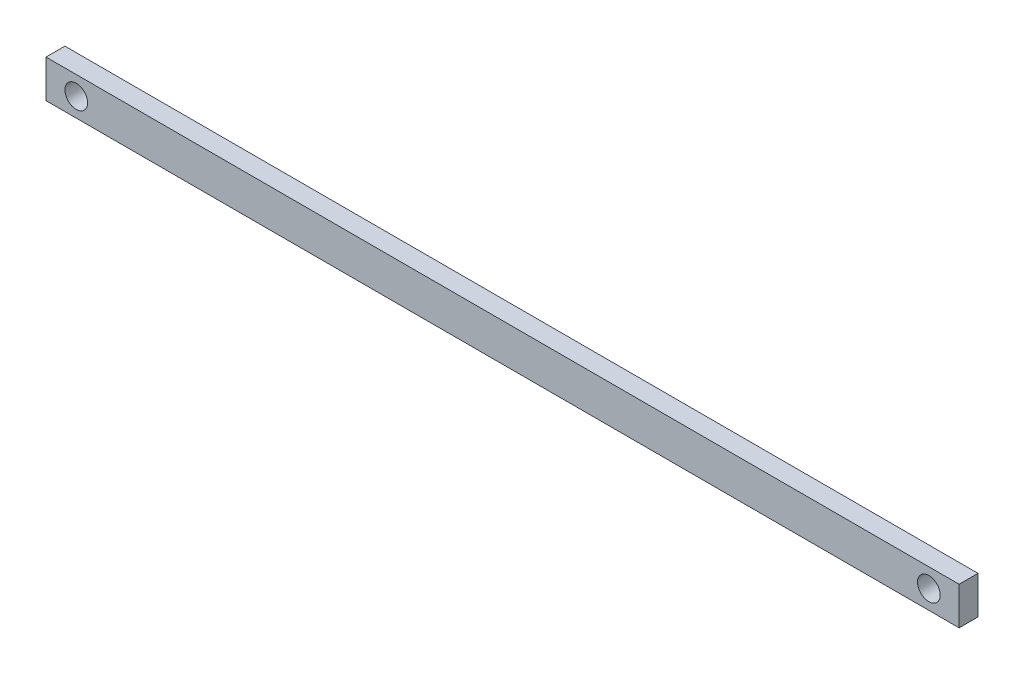
from build123d import *

# Parameters (mm, degrees)
SKETCH1_W               = 604
SKETCH1_H               = 25
SKETCH1_R               = 7.5
BOSS_EXTRUDE1_DEPTH     = 25
CUT_EXTRUDE1_DEPTH      = 605.646384261
CUT_EXTRUDE1_DEPTH_BACK = 605.646384261
SKETCH2_W               = 12.5
SKETCH2_H               = 25


with BuildPart() as part:
    # Sketch1 → Boss-Extrude1 (new body)
    with BuildSketch(Plane.XY):
        Rectangle(SKETCH1_W, SKETCH1_H)
        with Locations((-282, 0)):
            Circle(SKETCH1_R, mode=Mode.SUBTRACT)
        with Locations((282, 0)):
            Circle(SKETCH1_R, mode=Mode.SUBTRACT)
    extrude(amount=BOSS_EXTRUDE1_DEPTH)

    # Sketch2 → Cut-Extrude1 (cut, two sides: drawn at the far end of the back side and taken through both)
    with BuildSketch(Plane(origin=(302, 0, 0), x_dir=(0, 0, -1), z_dir=(1, 0, 0)).offset(-CUT_EXTRUDE1_DEPTH_BACK)):
        with Locations((-6.25, 0)):
            Rectangle(SKETCH2_W, SKETCH2_H)
    extrude(amount=CUT_EXTRUDE1_DEPTH + CUT_EXTRUDE1_DEPTH_BACK, mode=Mode.SUBTRACT)


solid = part.part
